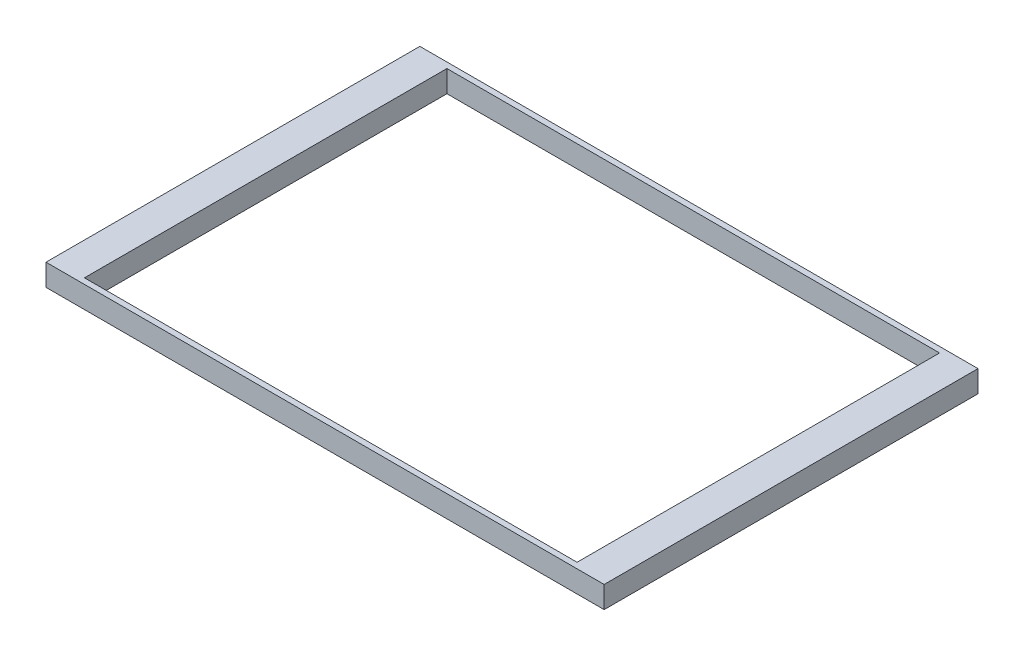
from build123d import *

# Parameters (mm, degrees)
SKETCH1_W           = 127.8
SKETCH1_H           = 85.6
BOSS_EXTRUDE1_DEPTH = 5
SKETCH2_W           = 112.8
SKETCH2_H           = 83
CUT_EXTRUDE1_DEPTH  = 5


with BuildPart() as part:
    # Sketch1 → Boss-Extrude1 (new body)
    with BuildSketch(Plane(origin=(0, 0, 0), x_dir=(1, 0, 0), z_dir=(0, 1, 0))):
        Rectangle(SKETCH1_W, SKETCH1_H)
    extrude(amount=BOSS_EXTRUDE1_DEPTH)

    # Sketch2 → Cut-Extrude1 (cut)
    with BuildSketch(Plane(origin=(0, 5, 0), x_dir=(1, 0, 0), z_dir=(0, 1, 0))):
        Rectangle(SKETCH2_W, SKETCH2_H)
    extrude(amount=-CUT_EXTRUDE1_DEPTH, mode=Mode.SUBTRACT)


solid = part.part
